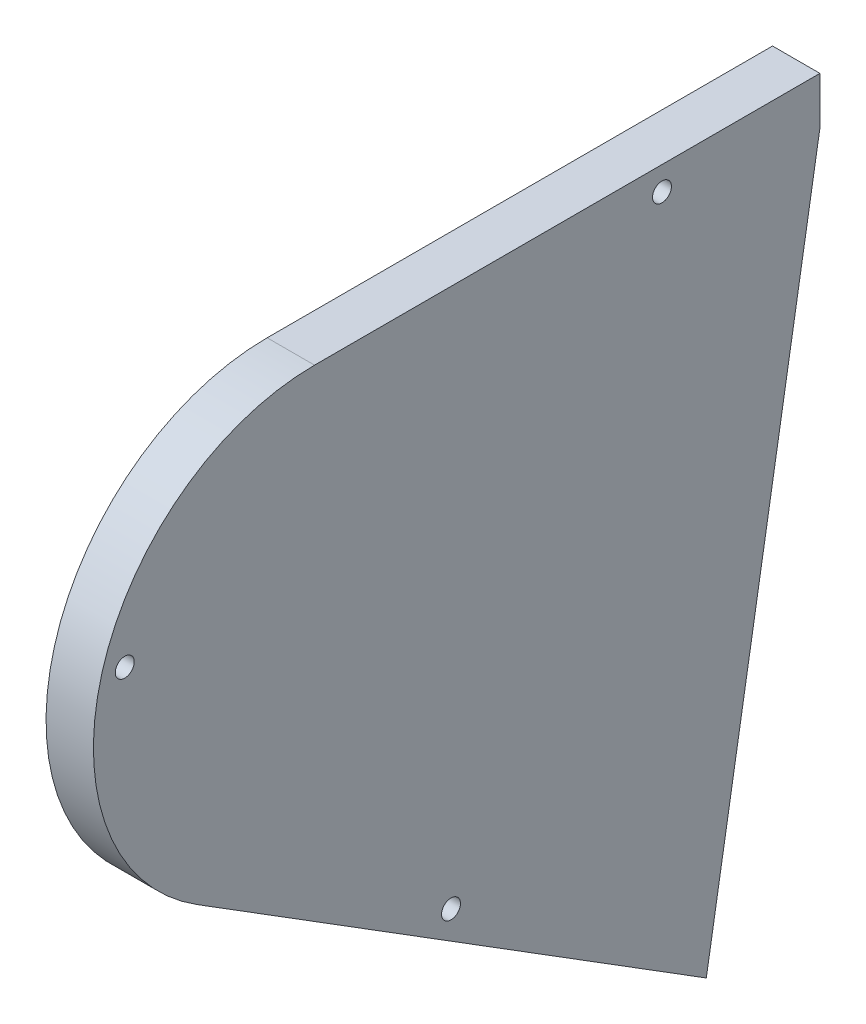
from build123d import *

# Parameters (mm, degrees)
SKETCH_2_W               = 3
SKETCH_2_H               = 32
EXTRUDE_1_DEPTH          = 3
EXTRUDE_2_DEPTH          = 3
EXTRUDE_3_DEPTH          = 3
CUT_EXTRUDE_1_DEPTH      = 64.046222373
CUT_EXTRUDE_1_DEPTH_BACK = 3
SKETCH_6_R               = 0.6
CUT_EXTRUDE_2_DEPTH      = 64.046222373


with BuildPart() as part:
    # 草图2 → 凸台-拉伸1 (new body)
    with BuildSketch(Plane(origin=(0, 0, 0), x_dir=(1, 0, 0), z_dir=(0, 1, 0))):
        with Locations((0, -16)):
            Rectangle(SKETCH_2_W, SKETCH_2_H)
    extrude(amount=EXTRUDE_1_DEPTH)

    # 草图3 → 凸台-拉伸2 (add)
    with BuildSketch(Plane(origin=(1.5, 0, 0), x_dir=(0, 0, -1), z_dir=(1, 0, 0))):
        with BuildLine():
            ThreePointArc((-37.829111907, -20.328529058), (-42.573878655, -7.967989086), (-32, 0))
            Line((-32, 0), (-23.339745962, 0))
            ThreePointArc((-23.339745962, 0), (-43.453167914, -2.948606038), (-39.418869699, -22.872673346))
            Line((-39.418869699, -22.872673346), (-7.193042045, -43.009605387))
            Line((-7.193042045, -43.009605387), (-5.603284253, -40.465461099))
            Line((-5.603284253, -40.465461099), (-37.829111907, -20.328529058))
        make_face()
    extrude(amount=-EXTRUDE_2_DEPTH)

    # 草图4 → 凸台-拉伸3 (add)
    with BuildSketch(Plane(origin=(1.5, 0, 0), x_dir=(0, 0, -1), z_dir=(1, 0, 0))):
        with BuildLine():
            Line((-6.657393053, -39.806780816), (0, 0))
            Line((0, 0), (-32, 0))
            ThreePointArc((-32, 0), (-42.573878655, -7.967989086), (-37.829111907, -20.328529058))
            Line((-37.829111907, -20.328529058), (-6.657393053, -39.806780816))
        make_face()
    extrude(amount=-EXTRUDE_3_DEPTH)

    # 草图5 → 切除-拉伸1 (cut, two sides: drawn at the far end of the back side and taken through both)
    with BuildSketch(Plane(origin=(1.5, 0, 0), x_dir=(0, 0, -1), z_dir=(1, 0, 0)).offset(-CUT_EXTRUDE_1_DEPTH_BACK)):
        Polygon((-6.657393053, -39.806780816), (-7.193042045, -43.009605387), (-5.603284253, -40.465461099), align=None)
    extrude(amount=CUT_EXTRUDE_1_DEPTH + CUT_EXTRUDE_1_DEPTH_BACK, mode=Mode.SUBTRACT)

    # 草图6 → 切除-拉伸2 (cut, through all)
    with BuildSketch(Plane(origin=(1.5, 0, 0), x_dir=(0, 0, -1), z_dir=(1, 0, 0))):
        with Locations((-10, 1.5)):
            Circle(SKETCH_6_R)
        with Locations((-44.015771199, -7.554533052)):
            Circle(SKETCH_6_R)
        with Locations((-23.359125072, -31.139147958)):
            Circle(SKETCH_6_R)
    extrude(amount=-CUT_EXTRUDE_2_DEPTH, mode=Mode.SUBTRACT)


solid = part.part
